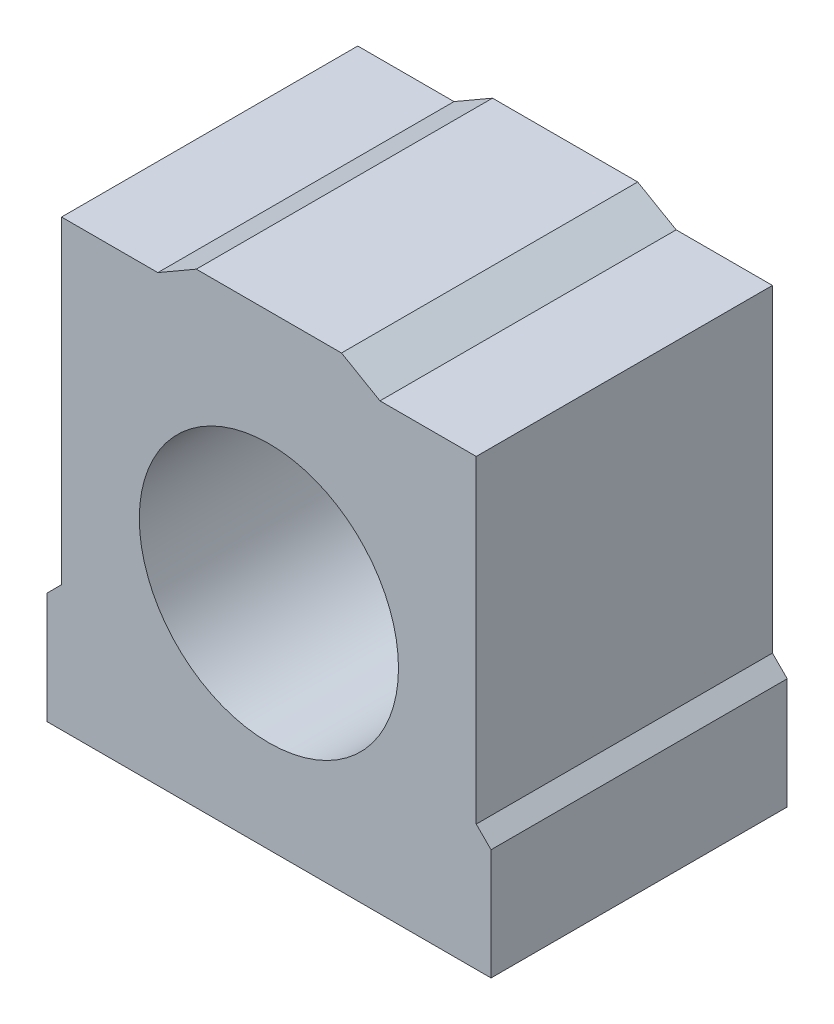
from build123d import *

# Parameters (mm, degrees)
CROQUIS1_R                    = 17.5
SALIENTE_EXTRUIR1_DEPTH       = 20
TALADRO_ROSCADO_1_4_201_D     = 5.1054
TALADRO_ROSCADO_1_4_201_DEPTH = 19.05
TALADRO_ROSCADO_1_4_201_TIP   = 1.533816902


with BuildPart() as part:
    # Croquis1 → Saliente-Extruir1 (new, symmetric)
    with BuildSketch(Plane.XY):
        Polygon((28, 60), (15, 60), (9.803847577, 63), (-9.803847577, 63), (-15, 60), (-28, 60), (-28, 17), (-30, 15), (-30, 0), (30, 0), (30, 15), (28, 17), align=None)
        with Locations((0, 30)):
            Circle(CROQUIS1_R, mode=Mode.SUBTRACT)
    extrude(amount=SALIENTE_EXTRUIR1_DEPTH, both=True)

    # Taladro roscado 1/4-201
    with Locations(Plane(origin=(0, 0, 0), x_dir=(-1, 0, 0), z_dir=(0, -1, 0))):
        with Locations((20, 10), (20, -10), (-20, -10), (-20, 10)):
            Hole(TALADRO_ROSCADO_1_4_201_D / 2, depth=TALADRO_ROSCADO_1_4_201_DEPTH)
            with Locations((0, 0, -(TALADRO_ROSCADO_1_4_201_DEPTH + TALADRO_ROSCADO_1_4_201_TIP / 2))):  # 118° drill point
                Cone(0, TALADRO_ROSCADO_1_4_201_D / 2, TALADRO_ROSCADO_1_4_201_TIP, mode=Mode.SUBTRACT)


solid = part.part
